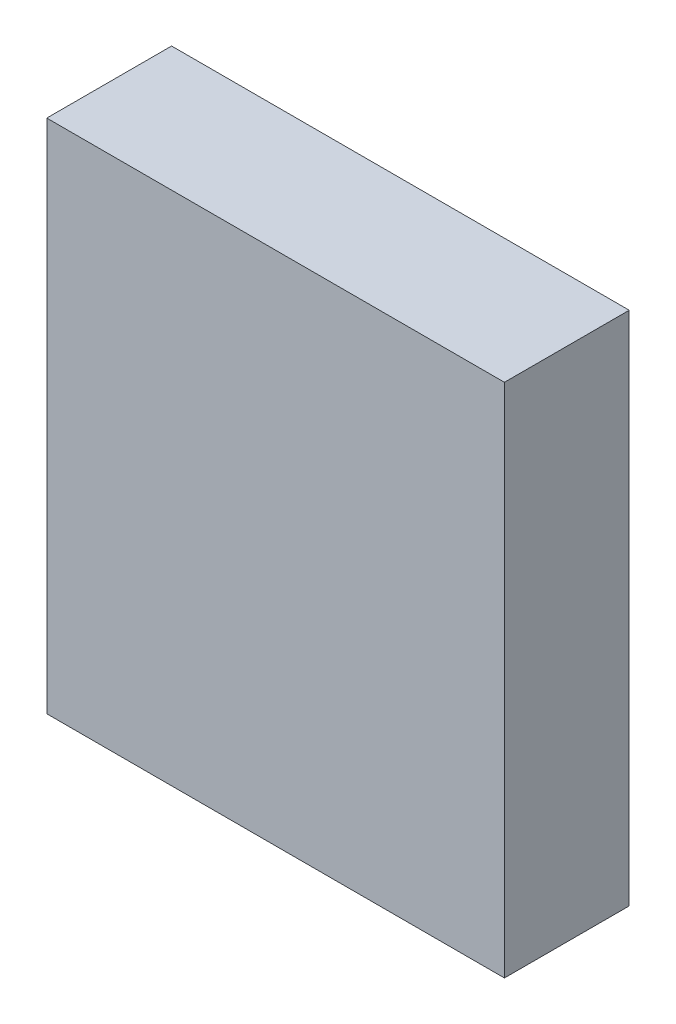
from build123d import *

# Parameters (mm, degrees)
ESQUISSE1_W        = 55
ESQUISSE1_H        = 62
BOSS_EXTRU_1_DEPTH = 15


with BuildPart() as part:
    # Esquisse1 → Boss.-Extru.1 (new body)
    with BuildSketch(Plane.XY):
        with Locations((6.370056497, -21.52259887)):
            Rectangle(ESQUISSE1_W, ESQUISSE1_H)
    extrude(amount=BOSS_EXTRU_1_DEPTH)


solid = part.part
